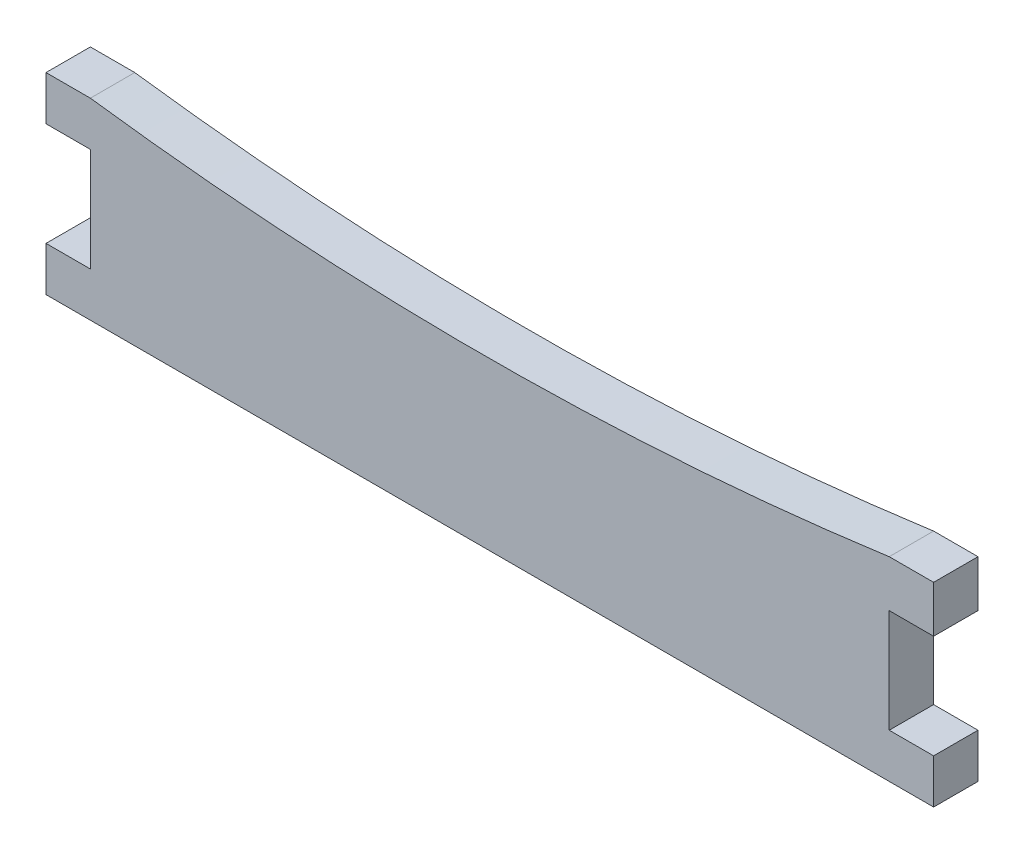
from build123d import *

# Parameters (mm, degrees)
BOSS_EXTRUDE1_DEPTH = 3.81


with BuildPart() as part:
    # Sketch1 → Boss-Extrude1 (new body)
    with BuildSketch(Plane.XY):
        with BuildLine():
            Line((-38.1, 0), (38.1, 0))
            Line((38.1, 0), (38.1, 3.81))
            Line((38.1, 3.81), (34.29, 3.81))
            Line((34.29, 3.81), (34.29, 12.7))
            Line((34.29, 12.7), (38.1, 12.7))
            Line((38.1, 12.7), (38.1, 16.711046713))
            Line((38.1, 16.711046713), (34.29, 16.711046713))
            ThreePointArc((34.29, 16.711046713), (0.006816557, 14.285295283), (-34.29, 16.51))
            Line((-34.29, 16.51), (-38.1, 16.51))
            Line((-38.1, 16.51), (-38.1, 12.7))
            Line((-38.1, 12.7), (-34.29, 12.7))
            Line((-34.29, 12.7), (-34.29, 3.81))
            Line((-34.29, 3.81), (-38.1, 3.81))
            Line((-38.1, 3.81), (-38.1, 0))
        make_face()
    extrude(amount=BOSS_EXTRUDE1_DEPTH)


solid = part.part
